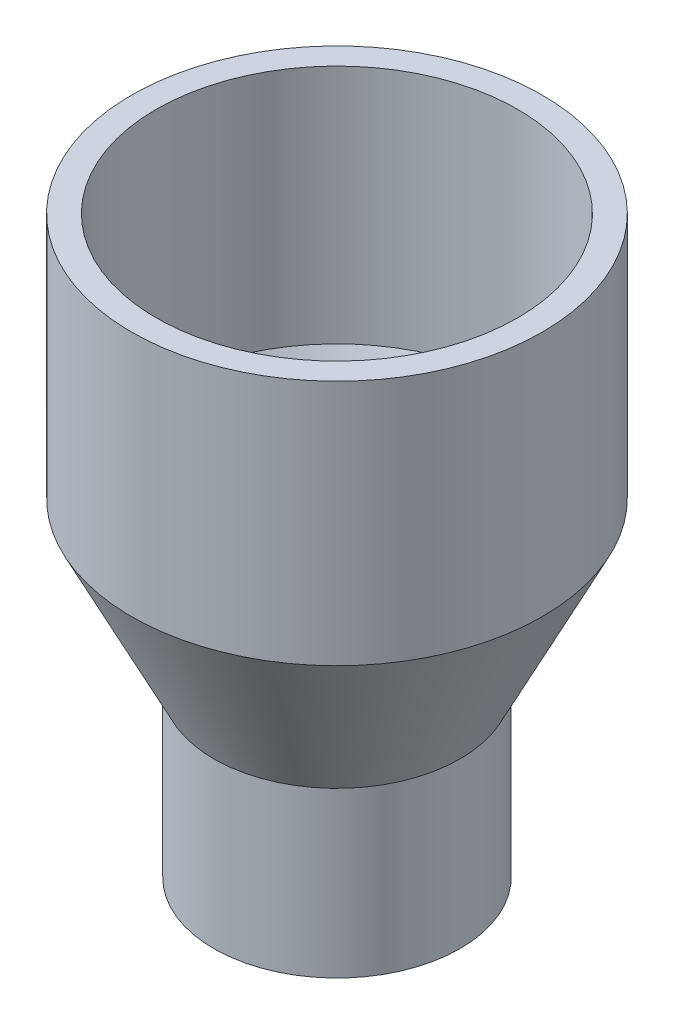
from build123d import *


with BuildPart() as part:
    # Sketch1 → Revolve1 (revolve)
    with BuildSketch(Plane.XY):
        Polygon((12.5, 17.5), (12.5, 2.5), (7.5, -7.5), (7.5, -17.5), (6, -17.5), (6, -7.145898034), (11, 2.854101966), (11, 17.5), align=None)
    revolve(axis=Axis((0, -17.5, 0), (0, 1, 0)))


solid = part.part
